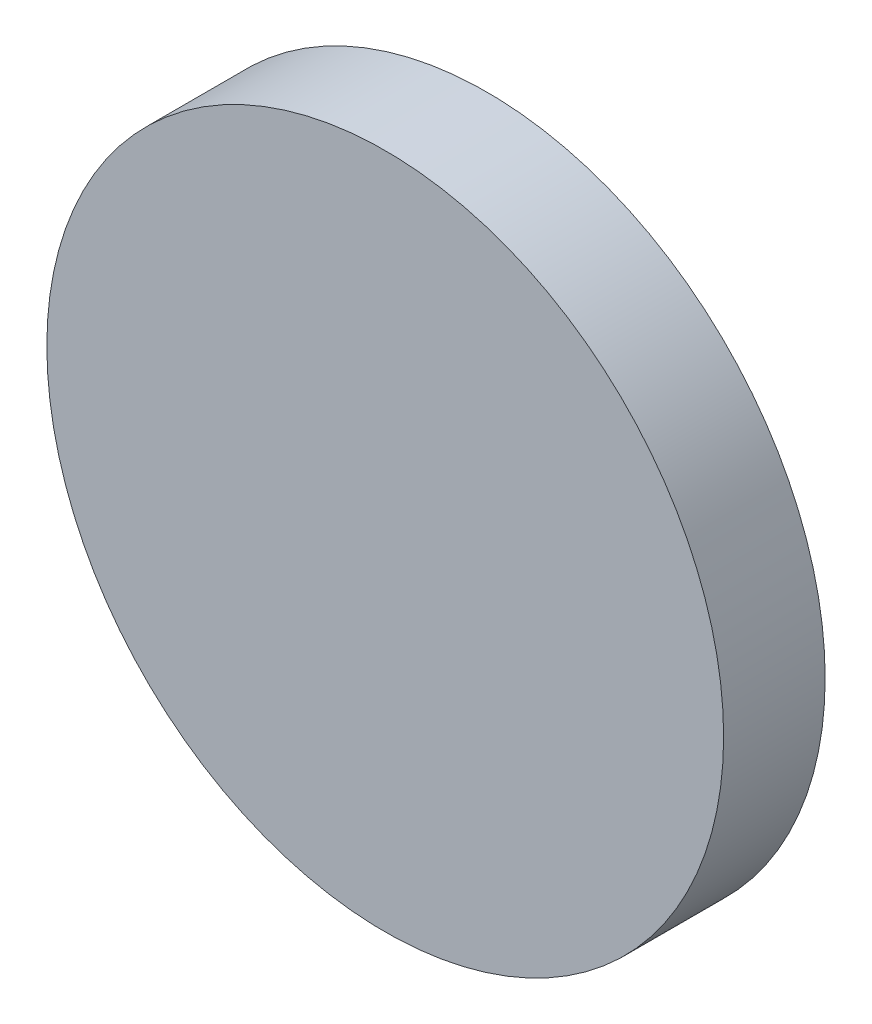
from build123d import *


with BuildPart() as part:
    # Sketch1 → Revolve1 (revolve)
    with BuildSketch(Plane(origin=(0, 0, 0), x_dir=(1, 0, 0), z_dir=(0, 1, 0))):
        Polygon((-50, -15), (0, -15), (0, -10), (-40, -10), (-40, 0), (-50, 0), align=None)
    revolve(axis=Axis((0, 0, 0), (0, 0, 1)))


solid = part.part
